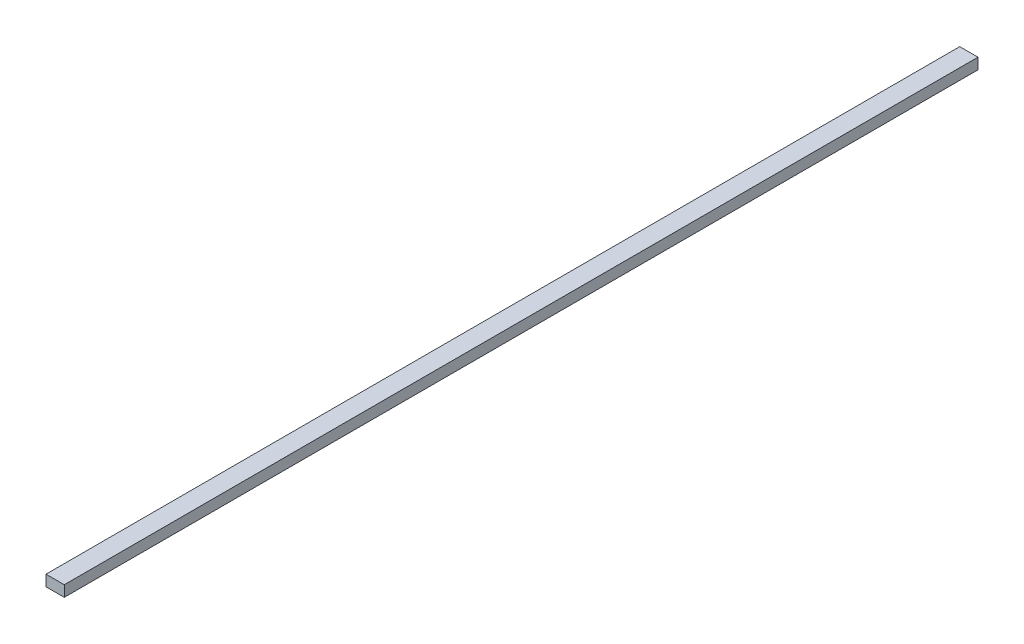
from build123d import *

# Parameters (mm, degrees)
SKETCH_1_W      = 50
SKETCH_1_H      = 30
EXTRUDE_1_DEPTH = 2500


with BuildPart() as part:
    # Эскиз1 → Бобышка-Вытянуть1 (new body)
    with BuildSketch(Plane.XY):
        with Locations((25, 15)):
            Rectangle(SKETCH_1_W, SKETCH_1_H)
    extrude(amount=-EXTRUDE_1_DEPTH)


solid = part.part
